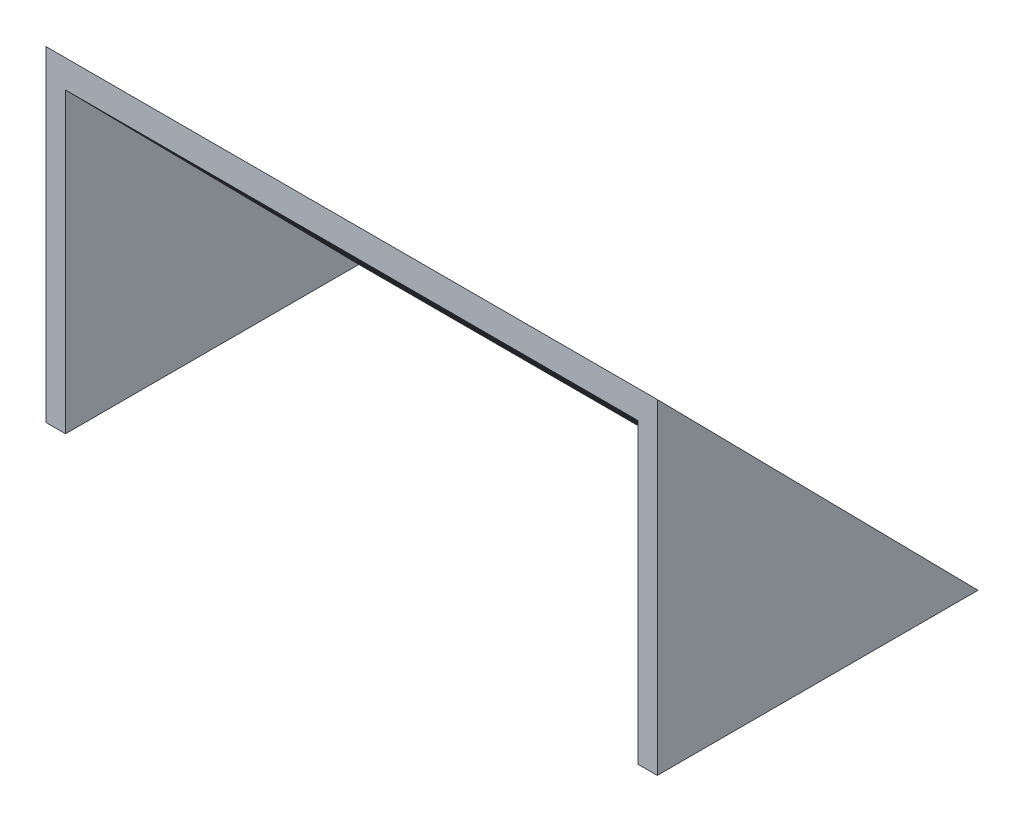
from build123d import *

# Parameters (mm, degrees)
P_IDAT_VYSUNUT_M1_DEPTH  = 1.2
SKICA2_W                 = 35.15
SKICA2_H                 = 28.072940708
P_IDAT_VYSUNUT_M2_DEPTH  = 1.2
LINPOLE1_COUNT           = 2
LINPOLE1_PITCH           = 36.35
SKICA3_W                 = 2.46853356
SKICA3_H                 = 4.337658353
SKICA3_W_2               = 5.363858138
SKICA3_H_2               = 3.395185275
ODEBRAT_VYSUNUT_M1_DEPTH = 47.88381917


with BuildPart() as part:
    # Skica1 → Přidat vysunutím1 (new body)
    with BuildSketch(Plane(origin=(0, 0, 0), x_dir=(0, 0, -1), z_dir=(1, 0, 0))):
        Polygon((0, 0), (0, 20), (19.7, 0), align=None)
    p_idat_vysunut_m1 = extrude(amount=P_IDAT_VYSUNUT_M1_DEPTH)

    # Skica2 → Přidat vysunutím2 (add)
    with BuildSketch(Plane(origin=(0, 9.848875128, -9.998857998), x_dir=(-1, 0, 0), z_dir=(0, 0.7017433693479112, -0.7124298165968641))):
        with Locations((-18.775, 0.212125978)):
            Rectangle(SKICA2_W, SKICA2_H)
    extrude(amount=-P_IDAT_VYSUNUT_M2_DEPTH)

    # LinPole1: Přidat vysunutím1 ×2
    with Locations(*[(i * LINPOLE1_PITCH, 0, 0) for i in range(1, LINPOLE1_COUNT)]):
        add(p_idat_vysunut_m1)

    # Skica3 → Odebrat vysunutím1 (cut, through all)
    with BuildSketch(Plane(origin=(37.55, 0, 0), x_dir=(0, 0, -1), z_dir=(1, 0, 0))):
        with Locations((-1.23426678, 19.003869159)):
            Rectangle(SKICA3_W, SKICA3_H)
        with Locations((19.532023183, -1.697592638)):
            Rectangle(SKICA3_W_2, SKICA3_H_2)
    extrude(amount=-ODEBRAT_VYSUNUT_M1_DEPTH, mode=Mode.SUBTRACT)


solid = part.part
